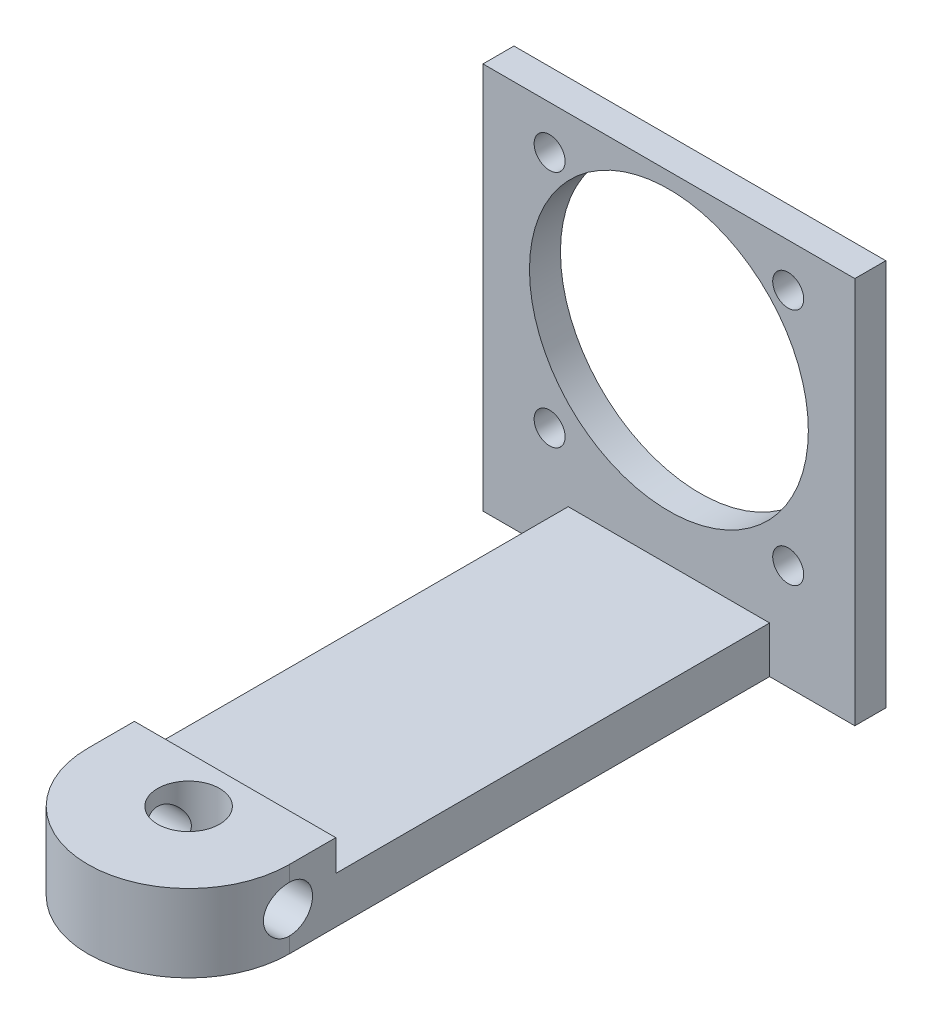
from build123d import *

# Parameters (mm, degrees)
SKETCH_2_R               = 6.5
EXTRUDE_1_DEPTH          = 5
SKETCH_3_R               = 2
CUT_EXTRUDE_2_DEPTH      = 11.464224768
EXTRUDE_START            = -5
EXTRUDE_2_DEPTH          = 5
EXTRUDE_3_DEPTH          = 2
SKETCH_22_R              = 9
SKETCH_22_R_2            = 1
CUT_EXTRUDE_4_DEPTH      = 2
CUT_EXTRUDE_6_DEPTH      = 44.104524125
CUT_EXTRUDE_6_DEPTH_BACK = 44.104524125
SKETCH_23_R              = 1.5
SKETCH_24_W              = 13
SKETCH_24_H              = 28
CUT_EXTRUDE_7_DEPTH      = 2


with BuildPart() as part:
    # 草图2 → 凸台-拉伸1 (new body)
    with BuildSketch(Plane(origin=(0, 0, 0), x_dir=(1, 0, 0), z_dir=(0, 1, 0))):
        with Locations(Location((0, 0, 0), (0, 0, 270))):
            Circle(SKETCH_2_R)
    extrude(amount=EXTRUDE_1_DEPTH)

    # 草图3 → 切除-拉伸2 (cut, through all)
    with BuildSketch(Plane(origin=(0, 5, 0), x_dir=(1, 0, 0), z_dir=(0, 1, 0))):
        with Locations(Location((0, 0, 0), (0, 0, 270))):
            Circle(SKETCH_3_R)
    extrude(amount=-CUT_EXTRUDE_2_DEPTH, mode=Mode.SUBTRACT)

    # 草图4 → 凸台-拉伸2 (add)
    with BuildSketch(Plane(origin=(0, 5, 0), x_dir=(1, 0, 0), z_dir=(0, 1, 0)).offset(EXTRUDE_START)):
        with BuildLine():
            Line((6.5, 0), (6.5, 31))
            Line((6.5, 31), (3.899148682, 31))
            Line((3.899148682, 31), (-4.100851318, 31))
            Line((-4.100851318, 31), (-6.5, 31))
            Line((-6.5, 31), (-6.5, 0))
            ThreePointArc((-6.5, 0), (0, 6.5), (6.5, 0))
        make_face()
    extrude(amount=EXTRUDE_2_DEPTH)

    # 草图21 → 凸台-拉伸3 (add)
    with BuildSketch(Plane(origin=(0, 0, -31), x_dir=(-1, 0, 0), z_dir=(0, 0, -1))):
        Polygon((0, 0), (12, 0), (12, 25), (-12, 25), (-12, 0), align=None)
    extrude(amount=EXTRUDE_3_DEPTH)

    # 草图22 → 切除-拉伸4 (cut)
    with BuildSketch(Plane.XY.offset(-31)):
        with Locations((0, 15)):
            Circle(SKETCH_22_R)
        with Locations((7.7, 22.2)):
            Circle(SKETCH_22_R_2)
        with Locations((-7.7, 22.2)):
            Circle(SKETCH_22_R_2)
        with Locations((-7.7, 6.8)):
            Circle(SKETCH_22_R_2)
        with Locations((7.7, 6.8)):
            Circle(SKETCH_22_R_2)
    extrude(amount=-CUT_EXTRUDE_4_DEPTH, mode=Mode.SUBTRACT)

    # 草图23 → 切除-拉伸6 (cut, two sides: drawn at the far end of the back side and taken through both)
    with BuildSketch(Plane(origin=(0, 0, 0), x_dir=(0, 0, -1), z_dir=(1, 0, 0)).offset(-CUT_EXTRUDE_6_DEPTH_BACK)):
        with Locations((0, 2.5)):
            Circle(SKETCH_23_R)
    extrude(amount=CUT_EXTRUDE_6_DEPTH + CUT_EXTRUDE_6_DEPTH_BACK, mode=Mode.SUBTRACT)

    # 草图24 → 切除-拉伸7 (cut)
    with BuildSketch(Plane(origin=(0, 5, 0), x_dir=(1, 0, 0), z_dir=(0, 1, 0))):
        with Locations((0, 17)):
            Rectangle(SKETCH_24_W, SKETCH_24_H)
    extrude(amount=-CUT_EXTRUDE_7_DEPTH, mode=Mode.SUBTRACT)


solid = part.part
